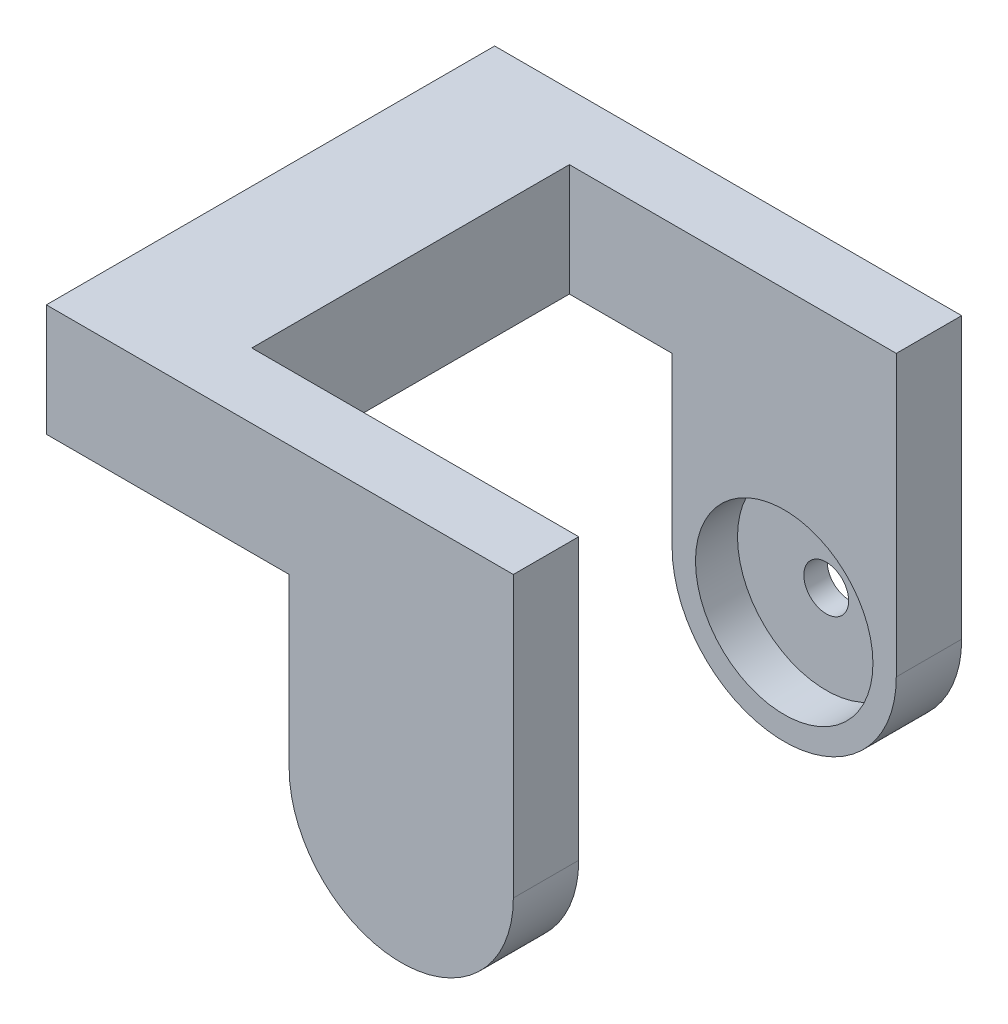
from build123d import *

# Parameters (mm, degrees)
SKETCH1_R           = 9.5
BOSS_EXTRUDE1_DEPTH = 48
SKETCH2_W           = 34
SKETCH2_H           = 30
CUT_EXTRUDE1_DEPTH  = 62.481704596
BOSS_EXTRUDE2_START = -2.5
SKETCH3_R           = 9.5
SKETCH3_R_2         = 2.4
BOSS_EXTRUDE2_DEPTH = 2.5
SKETCH4_R           = 9.5
SKETCH4_R_2         = 4.2
BOSS_EXTRUDE3_DEPTH = 7
SKETCH5_R           = 4.2
BOSS_EXTRUDE4_DEPTH = 11
BOSS_EXTRUDE5_DEPTH = 48
SKETCH7_W           = 35
SKETCH7_H           = 34
CUT_EXTRUDE2_DEPTH  = 14.5


with BuildPart() as part:
    # Sketch1 → Boss-Extrude1 (new body)
    with BuildSketch(Plane.XY):
        with BuildLine():
            Line((-12, 0), (-12, 30))
            Line((-12, 30), (12, 30))
            Line((12, 30), (12, 0))
            ThreePointArc((12, 0), (0, -12), (-12, 0))
        make_face()
        Circle(SKETCH1_R, mode=Mode.SUBTRACT)
    extrude(amount=-BOSS_EXTRUDE1_DEPTH)

    # Sketch2 → Cut-Extrude1 (cut, through all)
    with BuildSketch(Plane.ZY.offset(12)):
        with Locations((-24, 3)):
            Rectangle(SKETCH2_W, SKETCH2_H)
    extrude(amount=-CUT_EXTRUDE1_DEPTH, mode=Mode.SUBTRACT)

    # Sketch3 → Boss-Extrude2 (add)
    with BuildSketch(Plane(origin=(0, 0, -48), x_dir=(-1, 0, 0), z_dir=(0, 0, -1)).offset(BOSS_EXTRUDE2_START)):
        Circle(SKETCH3_R)
        Circle(SKETCH3_R_2, mode=Mode.SUBTRACT)
    extrude(amount=BOSS_EXTRUDE2_DEPTH)

    # Sketch4 → Boss-Extrude3 (add)
    with BuildSketch(Plane.XY):
        with Locations(Location((0, 0, 0), (0, 0, 180))):
            Circle(SKETCH4_R)
        Circle(SKETCH4_R_2, mode=Mode.SUBTRACT)
    extrude(amount=-BOSS_EXTRUDE3_DEPTH)

    # Sketch5 → Boss-Extrude4 (add)
    with BuildSketch(Plane.XY):
        Circle(SKETCH5_R)
    extrude(amount=-BOSS_EXTRUDE4_DEPTH)

    # Sketch6 → Boss-Extrude5 (add)
    with BuildSketch(Plane(origin=(0, 0, -48), x_dir=(-1, 0, 0), z_dir=(0, 0, -1))):
        Polygon((12, 30), (12, 18), (18, 18), (38, 18), (38, 30), align=None)
    extrude(amount=-BOSS_EXTRUDE5_DEPTH)

    # Sketch7 → Cut-Extrude2 (cut)
    with BuildSketch(Plane(origin=(0, 30, 0), x_dir=(1, 0, 0), z_dir=(0, 1, 0))):
        with Locations((-5.5, 24)):
            Rectangle(SKETCH7_W, SKETCH7_H)
    extrude(amount=-CUT_EXTRUDE2_DEPTH, mode=Mode.SUBTRACT)


solid = part.part
